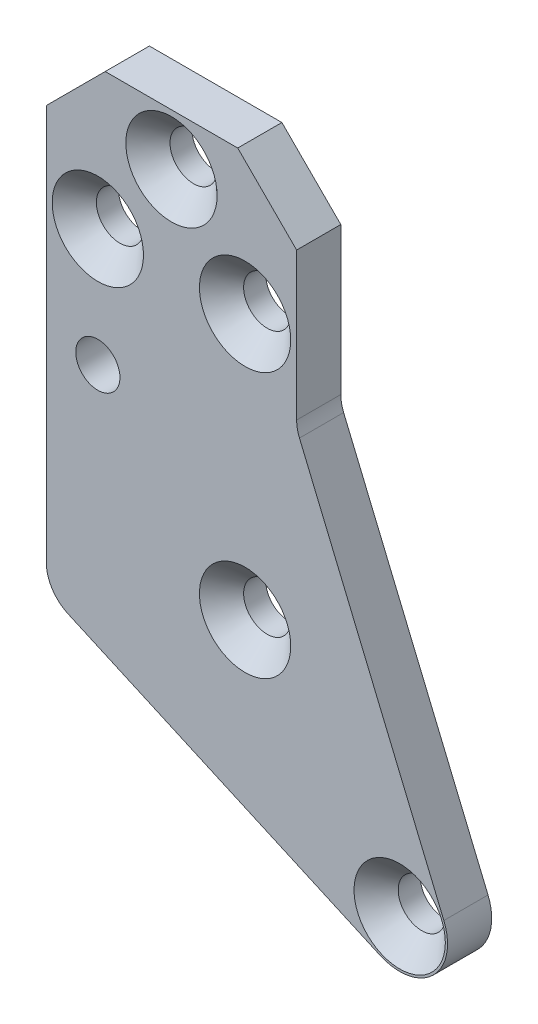
from build123d import *

# Parameters (mm, degrees)
SKETCH_1_R      = 1.5
SKETCH_1_R_2    = 1.6
EXTRUDE_1_DEPTH = 1.5
CHAMFER_1_SIZE  = 1.5
FILLET_1_R      = 2.5
CHAMFER_2_SIZE  = 4


with BuildPart() as part:
    # 草图1 → 凸台-拉伸1 (new, symmetric)
    with BuildSketch(Plane.XY):
        with BuildLine():
            Line((-3.5, 17.5), (-3.5, -15))
            Line((-3.5, -15), (19.171710101, -25.152700357))
            ThreePointArc((19.171710101, -25.152700357), (22.768840587, -24.513519167), (23.498822385, -20.933710945))
            Line((23.498822385, -20.933710945), (13.5, 3))
            Line((13.5, 3), (13.5, 17.5))
            Line((13.5, 17.5), (-3.5, 17.5))
        make_face()
        Circle(SKETCH_1_R, mode=Mode.SUBTRACT)
        with Locations((10, -10)):
            Circle(SKETCH_1_R_2, mode=Mode.SUBTRACT)
        with Locations((20.5, -22.186533479)):
            Circle(SKETCH_1_R_2, mode=Mode.SUBTRACT)
        with Locations((0, 8)):
            Circle(SKETCH_1_R_2, mode=Mode.SUBTRACT)
        with Locations((10, 8)):
            Circle(SKETCH_1_R_2, mode=Mode.SUBTRACT)
        with Locations((5, 14)):
            Circle(SKETCH_1_R_2, mode=Mode.SUBTRACT)
    extrude(amount=EXTRUDE_1_DEPTH, both=True)

    # 倒角1
    chamfer_1_edges = [part.edges().sort_by_distance(p)[0] for p in [
        (8.4, -10, 1.5),
        (18.9, -22.186533479, 1.5),
        (-1.6, 8, 1.5),
        (8.4, 8, 1.5),
        (3.4, 14, 1.5),
    ]]
    chamfer(chamfer_1_edges, length=CHAMFER_1_SIZE)

    # 圆角1
    fillet_1_edges = [part.edges().sort_by_distance(p)[0] for p in [
        (13.5, 3, 0),
        (-3.5, -15, 0),
    ]]
    fillet(fillet_1_edges, radius=FILLET_1_R)

    # 倒角2
    chamfer_2_edges = [part.edges().sort_by_distance(p)[0] for p in [
        (13.5, 17.5, 0),
        (-3.5, 17.5, 0),
    ]]
    chamfer(chamfer_2_edges, length=CHAMFER_2_SIZE)


solid = part.part
